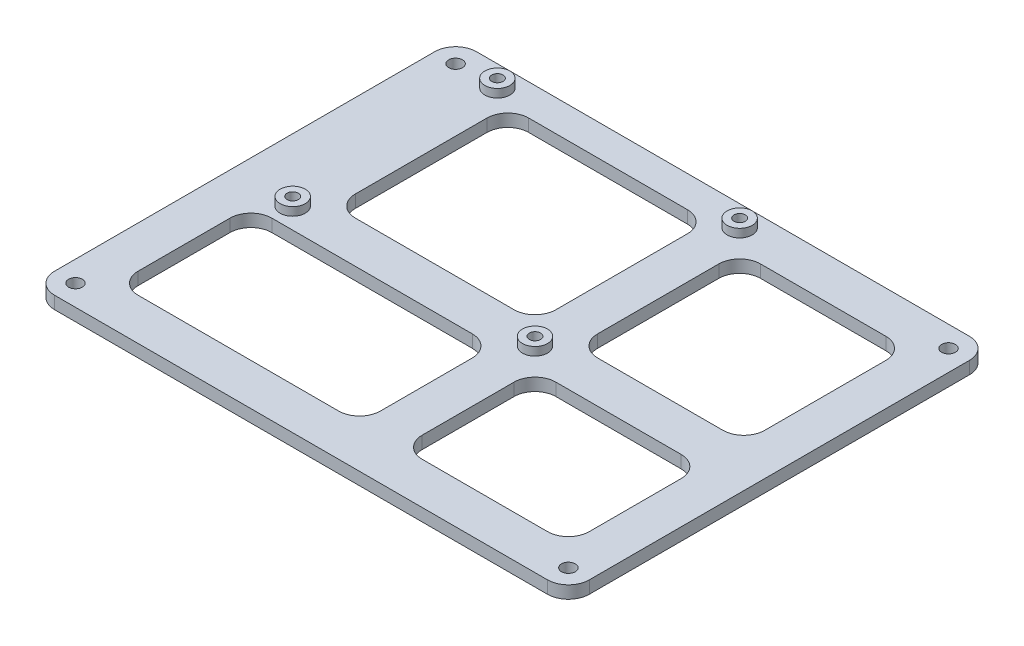
from build123d import *

# Parameters (mm, degrees)
SKETCH2_R           = 1.65
SKETCH2_R_2         = 1.35
BOSS_EXTRUDE1_DEPTH = 3
SKETCH3_R           = 3
SKETCH3_R_2         = 1.35
BOSS_EXTRUDE2_DEPTH = 2


with BuildPart() as part:
    # Sketch2 → Boss-Extrude1 (new body)
    with BuildSketch(Plane(origin=(0, 0, 0), x_dir=(1, 0, 0), z_dir=(0, 1, 0))):
        with BuildLine():
            Line((-66, 50.5), (52, 50.5))
            ThreePointArc((52, 50.5), (55.535533906, 49.035533906), (57, 45.5))
            Line((57, 45.5), (57, -45.5))
            ThreePointArc((57, -45.5), (55.535533906, -49.035533906), (52, -50.5))
            Line((52, -50.5), (-66, -50.5))
            ThreePointArc((-66, -50.5), (-69.535533906, -49.035533906), (-71, -45.5))
            Line((-71, -45.5), (-71, 45.5))
            ThreePointArc((-71, 45.5), (-69.535533906, 49.035533906), (-66, 50.5))
        make_face()
        with Locations(Location((52, 45.5, 0), (0, 0, 270))):
            Circle(SKETCH2_R, mode=Mode.SUBTRACT)
        with Locations(Location((52, -45.5, 0), (0, 0, 270))):
            Circle(SKETCH2_R, mode=Mode.SUBTRACT)
        with Locations(Location((-66, -45.5, 0), (0, 0, 270))):
            Circle(SKETCH2_R, mode=Mode.SUBTRACT)
        with Locations(Location((-66, 45.5, 0), (0, 0, 270))):
            Circle(SKETCH2_R, mode=Mode.SUBTRACT)
        with Locations(Location((-56, -3.5, 0), (0, 0, 270))):
            Circle(SKETCH2_R_2, mode=Mode.SUBTRACT)
        with Locations(Location((-56, 45.5, 0), (0, 0, 270))):
            Circle(SKETCH2_R_2, mode=Mode.SUBTRACT)
        with Locations(Location((2, 45.5, 0), (0, 0, 270))):
            Circle(SKETCH2_R_2, mode=Mode.SUBTRACT)
        with Locations(Location((2, -3.5, 0), (0, 0, 270))):
            Circle(SKETCH2_R_2, mode=Mode.SUBTRACT)
        with BuildLine():
            Line((12, 40.5), (42, 40.5))
            ThreePointArc((42, 40.5), (45.535533906, 39.035533906), (47, 35.5))
            Line((47, 35.5), (47, 6.5))
            ThreePointArc((47, 6.5), (45.535533906, 2.964466094), (42, 1.5))
            Line((42, 1.5), (12, 1.5))
            ThreePointArc((12, 1.5), (8.464466094, 2.964466094), (7, 6.5))
            Line((7, 6.5), (7, 35.5))
            ThreePointArc((7, 35.5), (8.464466094, 39.035533906), (12, 40.5))
        make_face(mode=Mode.SUBTRACT)
        with BuildLine():
            Line((12, -8.5), (42, -8.5))
            ThreePointArc((42, -8.5), (45.535533906, -9.964466094), (47, -13.5))
            Line((47, -13.5), (47, -35.5))
            ThreePointArc((47, -35.5), (45.535533906, -39.035533906), (42, -40.5))
            Line((42, -40.5), (12, -40.5))
            ThreePointArc((12, -40.5), (8.464466094, -39.035533906), (7, -35.5))
            Line((7, -35.5), (7, -13.5))
            ThreePointArc((7, -13.5), (8.464466094, -9.964466094), (12, -8.5))
        make_face(mode=Mode.SUBTRACT)
        with BuildLine():
            Line((-8, -8.5), (-56, -8.5))
            ThreePointArc((-56, -8.5), (-59.535533906, -9.964466094), (-61, -13.5))
            Line((-61, -13.5), (-61, -35.5))
            ThreePointArc((-61, -35.5), (-59.535533906, -39.035533906), (-56, -40.5))
            Line((-56, -40.5), (-8, -40.5))
            ThreePointArc((-8, -40.5), (-4.464466094, -39.035533906), (-3, -35.5))
            Line((-3, -35.5), (-3, -13.5))
            ThreePointArc((-3, -13.5), (-4.464466094, -9.964466094), (-8, -8.5))
        make_face(mode=Mode.SUBTRACT)
        with BuildLine():
            Line((-46, 43), (-8, 43))
            ThreePointArc((-8, 43), (-4.464466094, 41.535533906), (-3, 38))
            Line((-3, 38), (-3, 6.5))
            ThreePointArc((-3, 6.5), (-4.464466094, 2.964466094), (-8, 1.5))
            Line((-8, 1.5), (-46, 1.5))
            ThreePointArc((-46, 1.5), (-49.535533906, 2.964466094), (-51, 6.5))
            Line((-51, 6.5), (-51, 38))
            ThreePointArc((-51, 38), (-49.535533906, 41.535533906), (-46, 43))
        make_face(mode=Mode.SUBTRACT)
    extrude(amount=BOSS_EXTRUDE1_DEPTH)

    # Sketch3 → Boss-Extrude2 (add)
    # profile 1 of 4: a face of its own
    with BuildSketch(Plane(origin=(0, 3, 0), x_dir=(1, 0, 0), z_dir=(0, 1, 0))):
        with Locations(Location((-56, -3.5, 0), (0, 0, 270))):
            Circle(SKETCH3_R)
        with Locations(Location((-56, -3.5, 0), (0, 0, 270))):
            Circle(SKETCH3_R_2, mode=Mode.SUBTRACT)
    # profile 2 of 4: a face of its own
    with BuildSketch(Plane(origin=(0, 3, 0), x_dir=(1, 0, 0), z_dir=(0, 1, 0))):
        with Locations(Location((2, -3.5, 0), (0, 0, 270))):
            Circle(SKETCH3_R)
        with Locations(Location((2, -3.5, 0), (0, 0, 270))):
            Circle(SKETCH3_R_2, mode=Mode.SUBTRACT)
    # profile 3 of 4: a face of its own
    with BuildSketch(Plane(origin=(0, 3, 0), x_dir=(1, 0, 0), z_dir=(0, 1, 0))):
        with Locations(Location((2, 45.5, 0), (0, 0, 270))):
            Circle(SKETCH3_R)
        with Locations(Location((2, 45.5, 0), (0, 0, 270))):
            Circle(SKETCH3_R_2, mode=Mode.SUBTRACT)
    # profile 4 of 4: a face of its own
    with BuildSketch(Plane(origin=(0, 3, 0), x_dir=(1, 0, 0), z_dir=(0, 1, 0))):
        with Locations(Location((-56, 45.5, 0), (0, 0, 270))):
            Circle(SKETCH3_R)
        with Locations(Location((-56, 45.5, 0), (0, 0, 270))):
            Circle(SKETCH3_R_2, mode=Mode.SUBTRACT)
    extrude(amount=BOSS_EXTRUDE2_DEPTH)


solid = part.part
